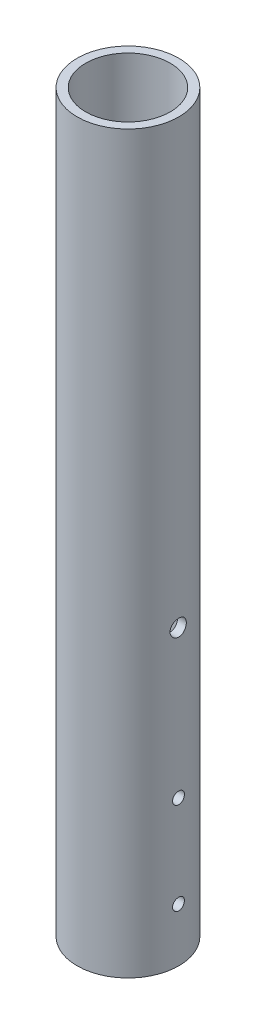
from build123d import *

# Parameters (mm, degrees)
SKETCH1_R                    = 21.082
SKETCH1_R_2                  = 17.526
BOSS_EXTRUDE1_DEPTH          = 304.8
F_10_0_1935_DIAMETER_HOLE1_D = 4.9149
F_1_4_CLEARANCE_HOLE1_D      = 6.7564


with BuildPart() as part:
    # Sketch1 → Boss-Extrude1 (new body)
    with BuildSketch(Plane(origin=(0, 0, 0), x_dir=(1, 0, 0), z_dir=(0, 1, 0))):
        with Locations(Location((0, 0, 0), (0, 0, 90))):
            Circle(SKETCH1_R)
        with Locations(Location((0, 0, 0), (0, 0, 90))):
            Circle(SKETCH1_R_2, mode=Mode.SUBTRACT)
    extrude(amount=BOSS_EXTRUDE1_DEPTH)

    # #10 (0.1935) Diameter Hole1 (through all)
    with Locations(Plane.ZY.offset(21.082)):
        with Locations((0, 22.225), (0, 60.325)):
            Hole(F_10_0_1935_DIAMETER_HOLE1_D / 2)

    # 1/4 Clearance Hole1 (through all)
    with Locations(Plane(origin=(-21.082, 0, 0), x_dir=(0, 0, -1), z_dir=(-1, 0, 0))):
        with Locations((0, -121.44375)):
            Hole(F_1_4_CLEARANCE_HOLE1_D / 2)


solid = part.part
